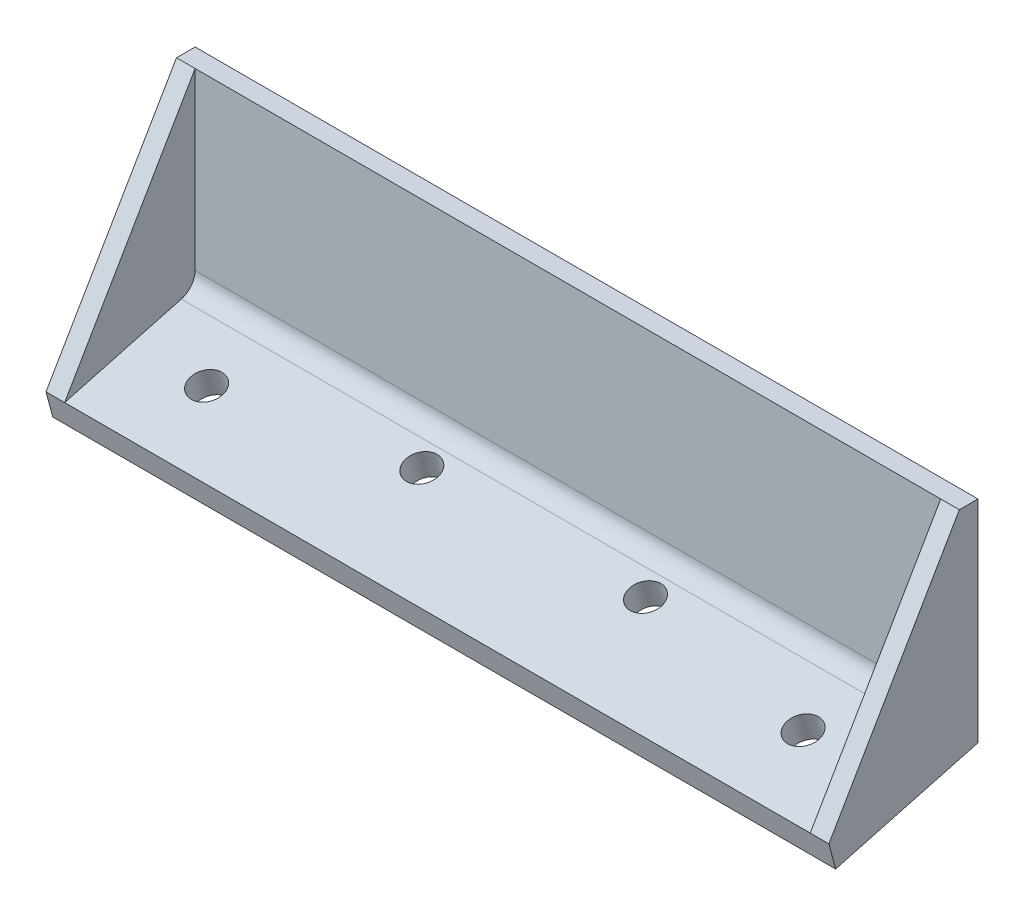
from build123d import *

# Parameters (mm, degrees)
EXTRUDE_1_DEPTH      = 30
SKETCH_2_R           = 44.45
CUT_EXTRUDE_1_DEPTH  = 4
SKETCH_3_R           = 25.5
SKETCH_3_R_2         = 2.25
CUT_EXTRUDE_2_DEPTH  = 188.619295383
CUT_EXTRUDE_3_DEPTH  = 189.215302247
SKETCH_5_R           = 1.65
CUT_EXTRUDE_4_DEPTH  = 189.215302247
EXTRUDE_START        = -30
EXTRUDE_2_DEPTH      = 30
CUT_EXTRUDE_5_DEPTH  = 198.040604952
CUT_EXTRUDE_7_DEPTH  = 233.432785983
CUT_EXTRUDE_8_DEPTH  = 233.432785983
CUT_EXTRUDE_9_DEPTH  = 233.432785983
FILLET_1_R           = 5
CUT_EXTRUDE_10_DEPTH = 233.432785983
EXTRUDE_START_2      = -5
EXTRUDE_3_DEPTH      = 5
EXTRUDE_4_DEPTH      = 5
SKETCH_14_R          = 4.25
CUT_EXTRUDE_11_DEPTH = 189.364728478
SKETCH_16_W          = 43
SKETCH_16_H          = 30
CUT_EXTRUDE_12_DEPTH = 233.432785983
EXTRUDE_7_REACH      = 188.592
SKETCH_18_W          = 210
SKETCH_18_H          = 5
EXTRUDE_8_DEPTH      = 210
EXTRUDE_9_DEPTH      = 5
EXTRUDE_10_DEPTH     = 5
SKETCH_22_R          = 4.25
CUT_EXTRUDE_13_DEPTH = 187.984035343
FILLET_2_R           = 5
SKETCH_23_W          = 158.512158041
SKETCH_23_H          = 103.317713915
CUT_EXTRUDE_14_DEPTH = 234.418610938


with BuildPart() as part:
    # 草图1 → 凸台-拉伸1 (new body)
    with BuildSketch(Plane(origin=(0, 0, 0), x_dir=(1, 0, 0), z_dir=(0, 1, 0))):
        with BuildLine():
            Line((170, 31.93), (170, -31.93))
            ThreePointArc((170, -31.93), (167.781993847, -38.210172909), (162.111885646, -41.704453387))
            Line((162.111885646, -41.704453387), (15.839142344, -73.308400404))
            ThreePointArc((15.839142344, -73.308400404), (-75, 0), (15.839142344, 73.308400404))
            Line((15.839142344, 73.308400404), (162.111885646, 41.704453387))
            ThreePointArc((162.111885646, 41.704453387), (167.781993847, 38.210172909), (170, 31.93))
        make_face()
    extrude(amount=EXTRUDE_1_DEPTH)

    # 草图2 → 切除-拉伸1 (cut)
    with BuildSketch(Plane(origin=(0, 30, 0), x_dir=(1, 0, 0), z_dir=(0, 1, 0))):
        with Locations(Location((0, 0, 0), (0, 0, 270))):
            Circle(SKETCH_2_R)
    extrude(amount=-CUT_EXTRUDE_1_DEPTH, mode=Mode.SUBTRACT)

    # 草图3 → 切除-拉伸2 (cut, through all)
    with BuildSketch(Plane(origin=(0, 26, 0), x_dir=(1, 0, 0), z_dir=(0, 1, 0))):
        with Locations(Location((0, 0, 0), (0, 0, 270))):
            Circle(SKETCH_3_R)
        with Locations(Location((0, 41, 0), (0, 0, 270))):
            Circle(SKETCH_3_R_2)
        with Locations(Location((28.991378029, 28.991378029, 0), (0, 0, 270))):
            Circle(SKETCH_3_R_2)
        with Locations(Location((41, 0, 0), (0, 0, 270))):
            Circle(SKETCH_3_R_2)
        with Locations(Location((28.991378029, -28.991378029, 0), (0, 0, 270))):
            Circle(SKETCH_3_R_2)
        with Locations(Location((0, -41, 0), (0, 0, 270))):
            Circle(SKETCH_3_R_2)
        with Locations(Location((-28.991378029, -28.991378029, 0), (0, 0, 270))):
            Circle(SKETCH_3_R_2)
        with Locations(Location((-41, 0, 0), (0, 0, 270))):
            Circle(SKETCH_3_R_2)
        with Locations(Location((-28.991378029, 28.991378029, 0), (0, 0, 270))):
            Circle(SKETCH_3_R_2)
    extrude(amount=-CUT_EXTRUDE_2_DEPTH, mode=Mode.SUBTRACT)

    # 草图4 → 切除-拉伸3 (cut, through all)
    with BuildSketch(Plane(origin=(0, 30, 0), x_dir=(1, 0, 0), z_dir=(0, 1, 0))):
        with BuildLine():
            Line((124, 18.5), (134, 18.5))
            ThreePointArc((134, 18.5), (152.5, 0), (134, -18.5))
            Line((134, -18.5), (124, -18.5))
            ThreePointArc((124, -18.5), (105.5, 0), (124, 18.5))
        make_face()
    extrude(amount=-CUT_EXTRUDE_3_DEPTH, mode=Mode.SUBTRACT)

    # 草图5 → 切除-拉伸4 (cut, through all)
    with BuildSketch(Plane(origin=(0, 30, 0), x_dir=(1, 0, 0), z_dir=(0, 1, 0))):
        with Locations(Location((116.75, 25.5, 0), (0, 0, 270))):
            Circle(SKETCH_5_R)
        with Locations(Location((141.25, 25.5, 0), (0, 0, 270))):
            Circle(SKETCH_5_R)
        with Locations(Location((141.25, -25.5, 0), (0, 0, 270))):
            Circle(SKETCH_5_R)
        with Locations(Location((116.75, -25.5, 0), (0, 0, 270))):
            Circle(SKETCH_5_R)
    extrude(amount=-CUT_EXTRUDE_4_DEPTH, mode=Mode.SUBTRACT)

    # 草图6 → 凸台-拉伸2 (add)
    with BuildSketch(Plane(origin=(0, 30, 0), x_dir=(1, 0, 0), z_dir=(0, 1, 0)).offset(EXTRUDE_START)):
        with BuildLine():
            Line((158, 95), (-52, 95))
            Line((-52, 95), (-52, 54.046276467))
            ThreePointArc((-52, 54.046276467), (-20.48558667, 72.148047366), (15.839142344, 73.308400404))
            Line((15.839142344, 73.308400404), (158, 42.592874655))
            Line((158, 42.592874655), (158, 95))
        make_face()
        with BuildLine():
            ThreePointArc((15.839142344, -73.308400404), (-20.48558667, -72.148047366), (-52, -54.046276467))
            Line((-52, -54.046276467), (-52, -95))
            Line((-52, -95), (158, -95))
            Line((158, -95), (158, -42.592874655))
            Line((158, -42.592874655), (15.839142344, -73.308400404))
        make_face()
    extrude(amount=EXTRUDE_2_DEPTH)

    # 草图7 → 切除-拉伸5 (cut, through all)
    with BuildSketch(Plane(origin=(0, 30, 0), x_dir=(1, 0, 0), z_dir=(0, 1, 0))):
        with BuildLine():
            Line((-52, 54.046276467), (-52, -54.046276467))
            ThreePointArc((-52, -54.046276467), (-75, 0), (-52, 54.046276467))
        make_face()
        with BuildLine():
            Line((158, 42.592874655), (158, -42.592874655))
            Line((158, -42.592874655), (162.111885646, -41.704453387))
            ThreePointArc((162.111885646, -41.704453387), (167.781993847, -38.210172909), (170, -31.93))
            Line((170, -31.93), (170, 31.93))
            ThreePointArc((170, 31.93), (167.781993847, 38.210172909), (162.111885646, 41.704453387))
            Line((162.111885646, 41.704453387), (158, 42.592874655))
        make_face()
    extrude(amount=-CUT_EXTRUDE_5_DEPTH, mode=Mode.SUBTRACT)

    # 草图9 → 切除-拉伸7 (cut, through all)
    with BuildSketch(Plane.ZY.offset(52)):
        Polygon((-95, 20), (-60, 10.621778265), (-60, 30), (-95, 30), align=None)
    extrude(amount=-CUT_EXTRUDE_7_DEPTH, mode=Mode.SUBTRACT)

    # 草图10 → 切除-拉伸8 (cut, through all)
    with BuildSketch(Plane.ZY.offset(52)):
        Polygon((-95, 12.753066737), (-52, 1.231251463), (-52, 0), (-95, 0), align=None)
    extrude(amount=-CUT_EXTRUDE_8_DEPTH, mode=Mode.SUBTRACT)

    # 草图8 → 切除-拉伸9 (cut, through all)
    with BuildSketch(Plane.ZY.offset(52)):
        Polygon((0, 0), (52, 0), (52, 17.3), (-52, 17.3), (-52, 0), align=None)
    extrude(amount=-CUT_EXTRUDE_9_DEPTH, mode=Mode.SUBTRACT)

    # 圆角1
    fillet_1_edges = [part.edges().sort_by_distance(p)[0] for p in [
        (53, 10.621778265, -60),
    ]]
    fillet(fillet_1_edges, radius=FILLET_1_R)

    # 草图11 → 切除-拉伸10 (cut, through all)
    with BuildSketch(Plane.ZY.offset(52)):
        Polygon((-95, 12.753066737), (-93.188266684, 19.514547521), (-95, 20), align=None)
    extrude(amount=-CUT_EXTRUDE_10_DEPTH, mode=Mode.SUBTRACT)

    # 草图12 → 凸台-拉伸3 (add)
    with BuildSketch(Plane.ZY.offset(52).offset(EXTRUDE_START_2)):
        with BuildLine():
            Line((-93.188266684, 19.514547521), (-60, 30))
            Line((-60, 30), (-60, 17.137905129))
            ThreePointArc((-60, 17.137905129), (-61.956192855, 13.171138428), (-66.294095226, 12.308275998))
            Line((-66.294095226, 12.308275998), (-93.188266684, 19.514547521))
        make_face()
    extrude(amount=EXTRUDE_3_DEPTH)

    # 草图13 → 凸台-拉伸4 (add)
    with BuildSketch(Plane(origin=(158, 0, 0), x_dir=(0, 0, -1), z_dir=(1, 0, 0))):
        with BuildLine():
            Line((66.294095226, 12.308275998), (93.188266684, 19.514547521))
            Line((93.188266684, 19.514547521), (60, 30))
            Line((60, 30), (60, 17.137905129))
            ThreePointArc((60, 17.137905129), (61.956192855, 13.171138428), (66.294095226, 12.308275998))
        make_face()
    extrude(amount=-EXTRUDE_4_DEPTH)

    # 草图14 → 切除-拉伸11 (cut, through all)
    with BuildSketch(Plane(origin=(0, -5.089745962, -1.36379332), x_dir=(1, 0, 0), z_dir=(0, 0.9659258262890681, 0.2588190451025214))):
        with Locations(Location((-27, 82.063690052, 0), (0, 0, 270))):
            Circle(SKETCH_14_R)
        with Locations(Location((23, 82.063690052, 0), (0, 0, 270))):
            Circle(SKETCH_14_R)
        with Locations(Location((83, 82.063690052, 0), (0, 0, 270))):
            Circle(SKETCH_14_R)
        with Locations(Location((133, 82.063690052, 0), (0, 0, 270))):
            Circle(SKETCH_14_R)
    extrude(amount=-CUT_EXTRUDE_11_DEPTH, mode=Mode.SUBTRACT)

    # 草图16 → 切除-拉伸12 (cut, through all)
    with BuildSketch(Plane.ZY.offset(52)):
        with Locations((73.5, 15)):
            Rectangle(SKETCH_16_W, SKETCH_16_H)
    extrude(amount=-CUT_EXTRUDE_12_DEPTH, mode=Mode.SUBTRACT)

    # 凸台-拉伸7: up to this plane
    extrude_7_end = Plane(origin=(0, -11.851226746, -3.175526636), z_dir=(0, -0.9659258262890681, -0.25881904510252146))
    # 草图18 → 凸台-拉伸7 (add, up to the surface)
    with BuildSketch(Plane(origin=(0, 30, 0), x_dir=(1, 0, 0), z_dir=(0, 1, 0)), mode=Mode.PRIVATE) as extrude_7_sk1:
        with Locations((53, -54.5)):
            Rectangle(SKETCH_18_W, SKETCH_18_H)
    extrude_7_tool1 = split(extrude(extrude_7_sk1.sketch, amount=-EXTRUDE_7_REACH, mode=Mode.PRIVATE), bisect_by=extrude_7_end, keep=Keep.BOTH, mode=Mode.PRIVATE)
    add(extrude_7_tool1.solids().sort_by_distance((53, 30, 54.5))[0])

    # 草图19 → 凸台-拉伸8 (add)
    with BuildSketch(Plane.ZY.offset(52)):
        Polygon((57, -27.975210512), (90.188266684, -36.867979769), (92, -30.106498985), (57, -20.72827725), align=None)
    extrude(amount=-EXTRUDE_8_DEPTH)

    # 草图20 → 凸台-拉伸9 (add)
    with BuildSketch(Plane.ZY.offset(52)):
        Polygon((92, -30.106498985), (57, -20.72827725), (57, 30), align=None)
    extrude(amount=-EXTRUDE_9_DEPTH)

    # 草图21 → 凸台-拉伸10 (add)
    with BuildSketch(Plane(origin=(158, 0, 0), x_dir=(0, 0, -1), z_dir=(1, 0, 0))):
        Polygon((-57, 30), (-92, -30.106498985), (-57, -20.72827725), align=None)
    extrude(amount=-EXTRUDE_10_DEPTH)

    # 草图22 → 切除-拉伸13 (cut, through all)
    with BuildSketch(Plane(origin=(0, -5.089745962, -1.36379332), x_dir=(1, 0, 0), z_dir=(0, 0.9659258262890686, 0.25881904510251946))):
        with Locations(Location((-27, -77.936309948, 0), (0, 0, 270))):
            Circle(SKETCH_22_R)
        with Locations(Location((23, -69.936309948, 0), (0, 0, 270))):
            Circle(SKETCH_22_R)
        with Locations(Location((83, -69.936309948, 0), (0, 0, 270))):
            Circle(SKETCH_22_R)
        with Locations(Location((133, -77.936309948, 0), (0, 0, 270))):
            Circle(SKETCH_22_R)
    extrude(amount=-CUT_EXTRUDE_13_DEPTH, mode=Mode.SUBTRACT)

    # 圆角2
    fillet_2_edges = [part.edges().sort_by_distance(p)[0] for p in [
        (53, -20.72827725, 57),
    ]]
    fillet(fillet_2_edges, radius=FILLET_2_R)

    # 草图23 → 切除-拉伸14 (cut, through all)
    with BuildSketch(Plane.ZY.offset(52)):
        with Locations((-27.256079021, 5.306767281)):
            Rectangle(SKETCH_23_W, SKETCH_23_H)
    extrude(amount=-CUT_EXTRUDE_14_DEPTH, mode=Mode.SUBTRACT)


solid = part.part
